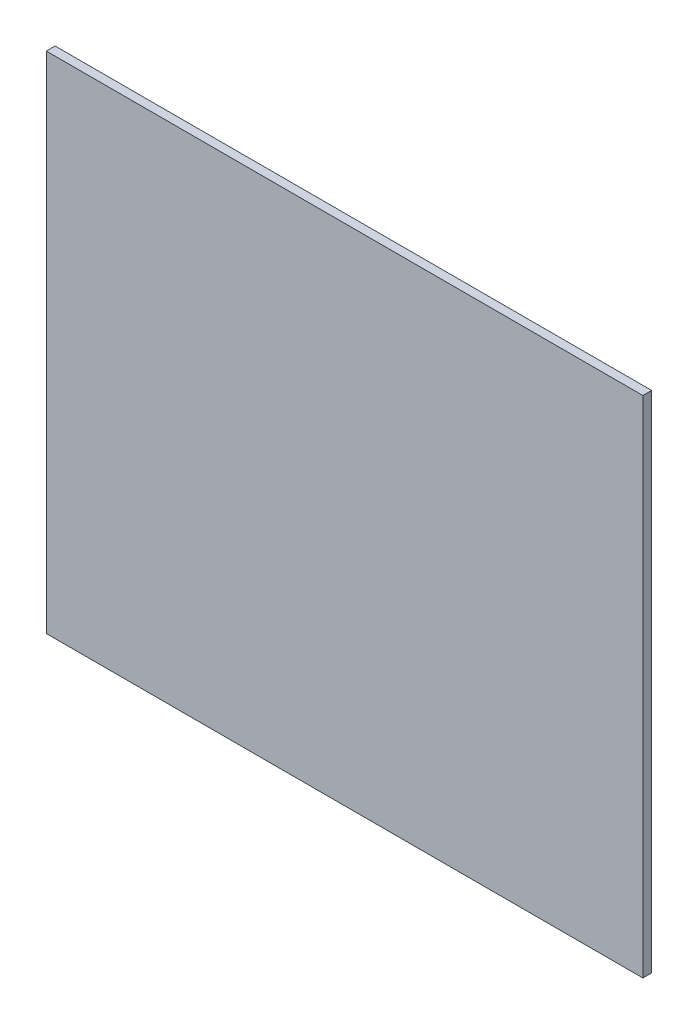
from build123d import *

# Parameters (mm, degrees)
CROQUIS1_W              = 680
CROQUIS1_H              = 575
SALIENTE_EXTRUIR1_DEPTH = 10


with BuildPart() as part:
    # Croquis1 → Saliente-Extruir1 (new body)
    with BuildSketch(Plane.XY):
        Rectangle(CROQUIS1_W, CROQUIS1_H)
    extrude(amount=SALIENTE_EXTRUIR1_DEPTH)


solid = part.part
